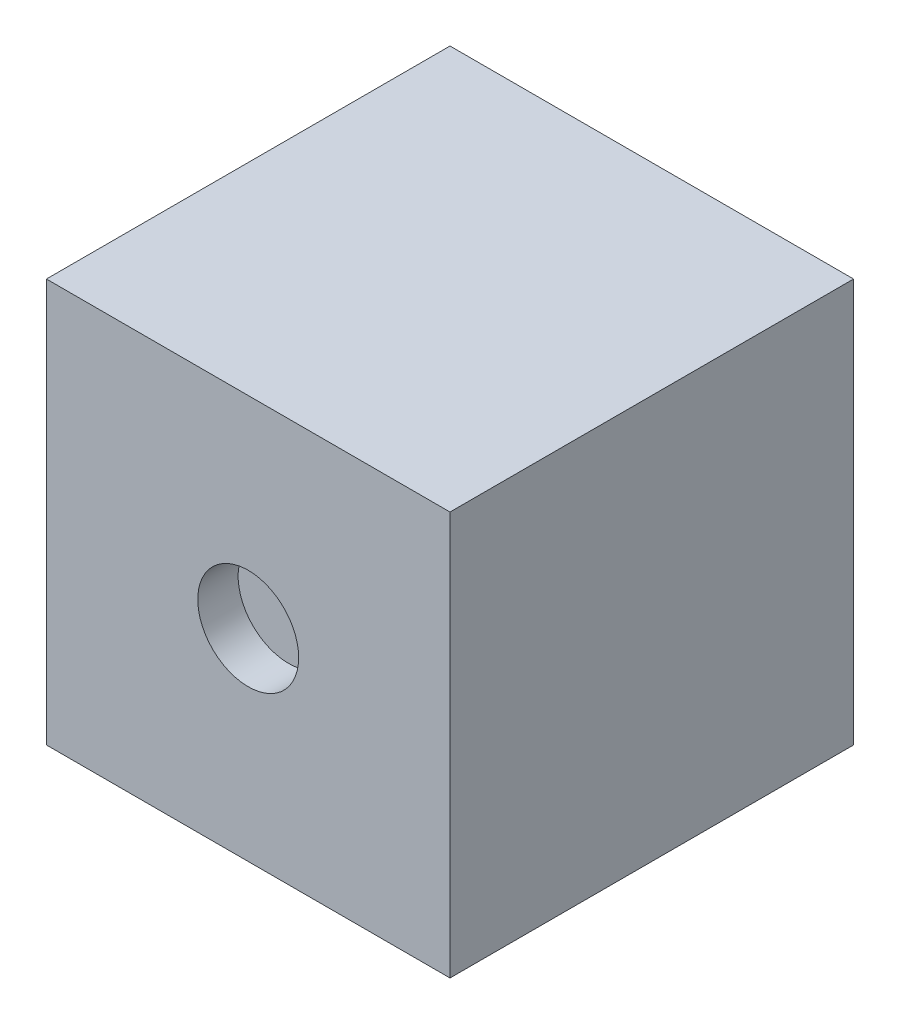
from build123d import *

# Parameters (mm, degrees)
ESQUISSE1_W             = 20
ESQUISSE1_H             = 20
BOSS_EXTRU_1_DEPTH      = 20
ESQUISSE2_R             = 2.5
ENL_V_MAT_EXTRU_1_DEPTH = 2


with BuildPart() as part:
    # Esquisse1 → Boss.-Extru.1 (new body)
    with BuildSketch(Plane.XY):
        with Locations((10, 10)):
            Rectangle(ESQUISSE1_W, ESQUISSE1_H)
    extrude(amount=-BOSS_EXTRU_1_DEPTH)

    # Esquisse2 → Enlèv. mat.-Extru.1 (cut)
    with BuildSketch(Plane.XY):
        with Locations((10, 10)):
            Circle(ESQUISSE2_R)
    extrude(amount=-ENL_V_MAT_EXTRU_1_DEPTH, mode=Mode.SUBTRACT)


solid = part.part
